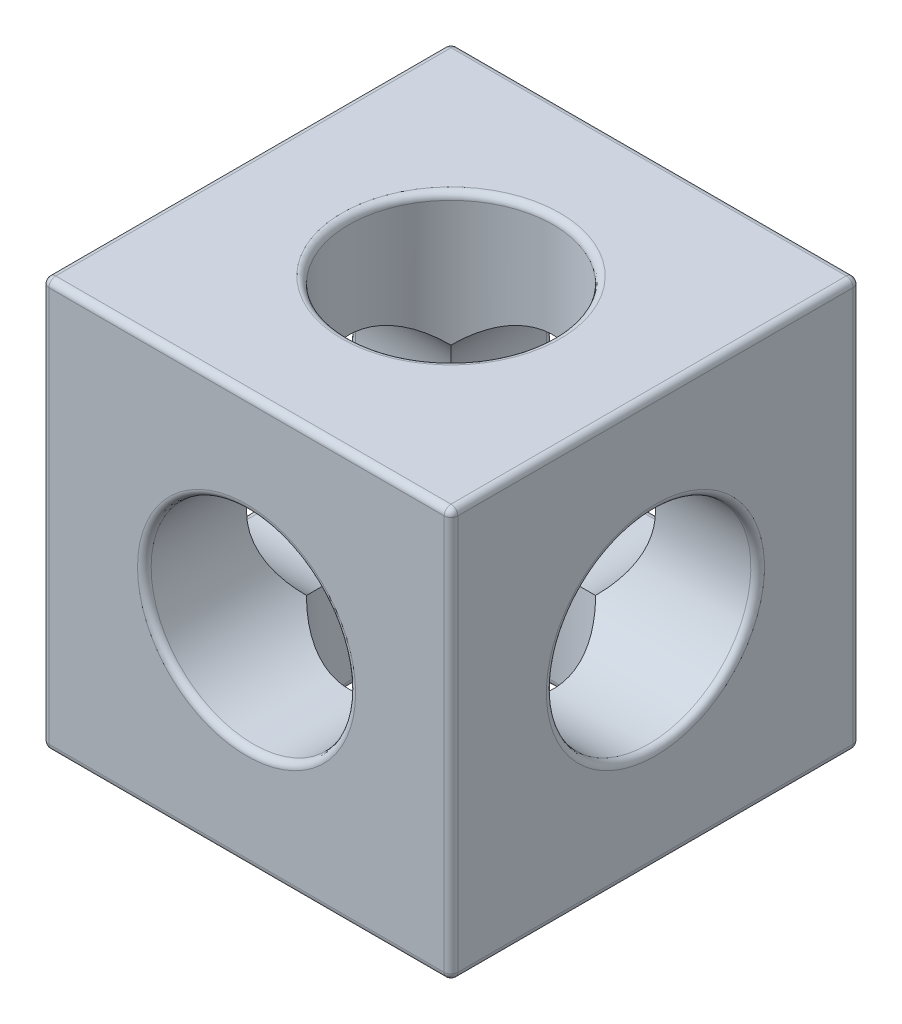
from build123d import *

# Parameters (mm, degrees)
SKETCH2_W           = 76.2
SKETCH2_H           = 76.2
BOSS_EXTRUDE2_DEPTH = 76.2
SKETCH3_R           = 19.05
CUT_EXTRUDE1_DEPTH  = 76.2
SKETCH4_R           = 19.05
CUT_EXTRUDE2_DEPTH  = 132.982271537
SKETCH5_R           = 19.05
CUT_EXTRUDE3_DEPTH  = 132.982271537
FILLET2_R           = 1.27


with BuildPart() as part:
    # Sketch2 → Boss-Extrude2 (new body)
    with BuildSketch(Plane.XY):
        with Locations((38.1, 38.1)):
            Rectangle(SKETCH2_W, SKETCH2_H)
    extrude(amount=BOSS_EXTRUDE2_DEPTH)

    # Sketch3 → Cut-Extrude1 (cut)
    with BuildSketch(Plane(origin=(0, 76.2, 0), x_dir=(1, 0, 0), z_dir=(0, 1, 0))):
        with Locations(Location((38.1, -38.1, 0), (0, 0, 270))):
            Circle(SKETCH3_R)
    extrude(amount=-CUT_EXTRUDE1_DEPTH, mode=Mode.SUBTRACT)

    # Sketch4 → Cut-Extrude2 (cut, through all)
    with BuildSketch(Plane(origin=(76.2, 0, 0), x_dir=(0, 0, -1), z_dir=(1, 0, 0))):
        with Locations(Location((-38.1, 38.1, 0), (0, 0, 90))):
            Circle(SKETCH4_R)
    extrude(amount=-CUT_EXTRUDE2_DEPTH, mode=Mode.SUBTRACT)

    # Sketch5 → Cut-Extrude3 (cut, through all)
    with BuildSketch(Plane(origin=(0, 0, 0), x_dir=(-1, 0, 0), z_dir=(0, 0, -1))):
        with Locations((-38.1, 38.1)):
            Circle(SKETCH5_R)
    extrude(amount=-CUT_EXTRUDE3_DEPTH, mode=Mode.SUBTRACT)

    # Fillet2
    fillet2_edges = [part.edges().sort_by_distance(p)[0] for p in [
        (76.2, 38.1, 76.2),
        (38.1, 0, 19.05),
        (38.1, 76.2, 19.05),
        (38.1, 76.2, 76.2),
        (0, 19.05, 38.1),
        (76.2, 19.05, 38.1),
        (57.15, 38.1, 76.2),
        (57.15, 38.1, 0),
        (0, 38.1, 76.2),
        (38.1, 76.2, 0),
        (76.2, 38.1, 0),
        (38.1, 0, 0),
        (0, 38.1, 0),
        (0, 76.2, 38.1),
        (76.2, 76.2, 38.1),
        (76.2, 0, 38.1),
        (0, 0, 38.1),
        (38.1, 0, 76.2),
    ]]
    fillet(fillet2_edges, radius=FILLET2_R)


solid = part.part
